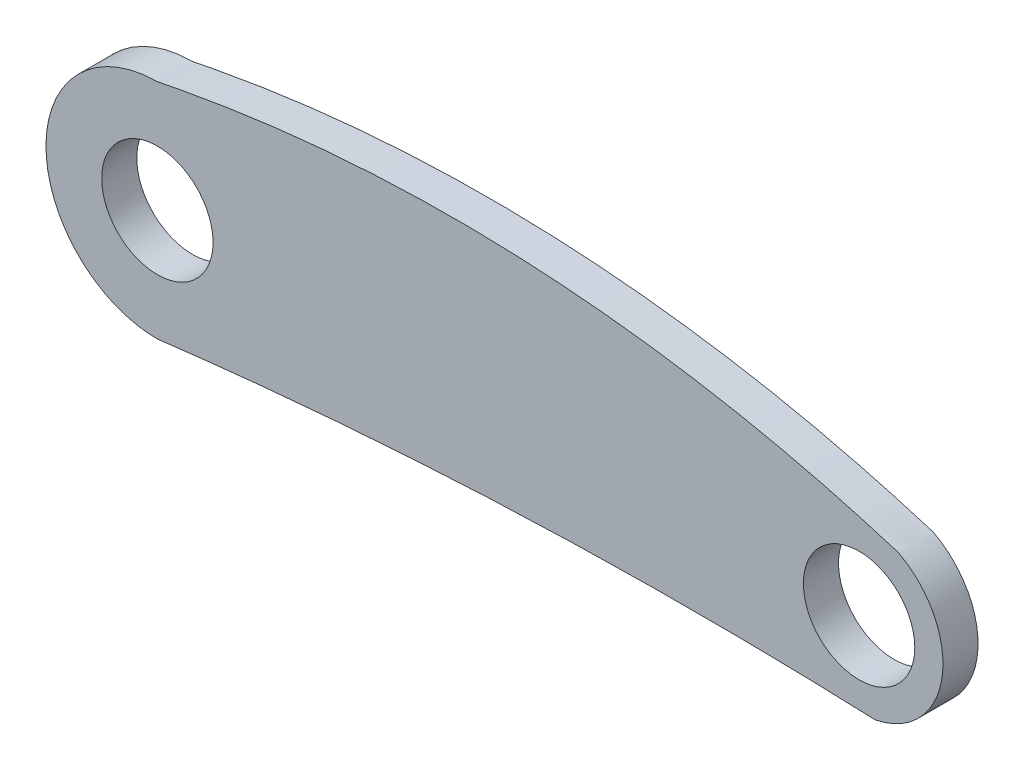
from build123d import *

# Parameters (mm, degrees)
CROQUIS1_R              = 3.175
SALIENTE_EXTRUIR1_DEPTH = 2


with BuildPart() as part:
    # Croquis1 → Saliente-Extruir1 (new body)
    with BuildSketch(Plane.XY):
        with BuildLine():
            add(Edge.make_bspline(
                [(40.911857792, -4.694071276), (27.244779748, -4.134195474), (13.577429244, -4.687380242), (0.000304994, -6.349962652), (0.00023646, -6.349971044), (9.9393e-05, -6.349987829), (-0.000108156, -6.35), (-0.000246247, -6.349999996), (-0.000315292, -6.349999992), (-12.69915953, -6.349369465), (-12.69910687, 6.349474788), (-0.000262627, 6.349999995), (-0.000205283, 6.349999997), (-9.0596e-05, 6.35), (8.2365e-05, 6.350016828), (0.000194731, 6.350039785), (0.000250915, 6.350051263), (14.10659534, 9.232030386), (28.486198573, 8.509695588), (42.232716949, 4.228575495), (42.23275682, 4.228563078), (42.23283656, 4.228538244), (42.232953121, 4.228489517), (42.233026973, 4.228450516), (42.233063899, 4.228431016), (47.023559261, 1.698537017), (46.230230281, -3.660552327), (40.912231856, -4.694042636), (40.912190938, -4.694050588), (40.9121091, -4.694066491), (40.91198274, -4.694076395), (40.911899442, -4.694072982), (40.911857792, -4.694071276)],
                knots=[0, 0, 0, 0, 0.390129853, 0.390129853, 0.390129853, 0.390131826, 0.3901338, 0.390135774, 0.390135774, 0.390135774, 0.511143053, 0.511143053, 0.511143053, 0.511144692, 0.511146332, 0.511147971, 0.511147971, 0.511147971, 0.914051873, 0.914051873, 0.914051873, 0.914053067, 0.914054261, 0.914055454, 0.914055454, 0.914055454, 0.999996425, 0.999996425, 0.999996425, 0.999997617, 0.999998808, 1, 1, 1, 1], degree=3, weights=[1, 0.997792825, 0.997792825, 1, 1, 1, 1, 1, 1, 0.33336367, 0.33336367, 1, 1, 1, 1, 1, 1, 0.978990063, 0.978990063, 1, 1, 1, 1, 1, 1, 0.554974492, 0.554974492, 1, 1, 1, 1, 1, 1]))
        make_face()
        with Locations((40, 0)):
            Circle(CROQUIS1_R, mode=Mode.SUBTRACT)
        Circle(CROQUIS1_R, mode=Mode.SUBTRACT)
    extrude(amount=SALIENTE_EXTRUIR1_DEPTH)


solid = part.part
